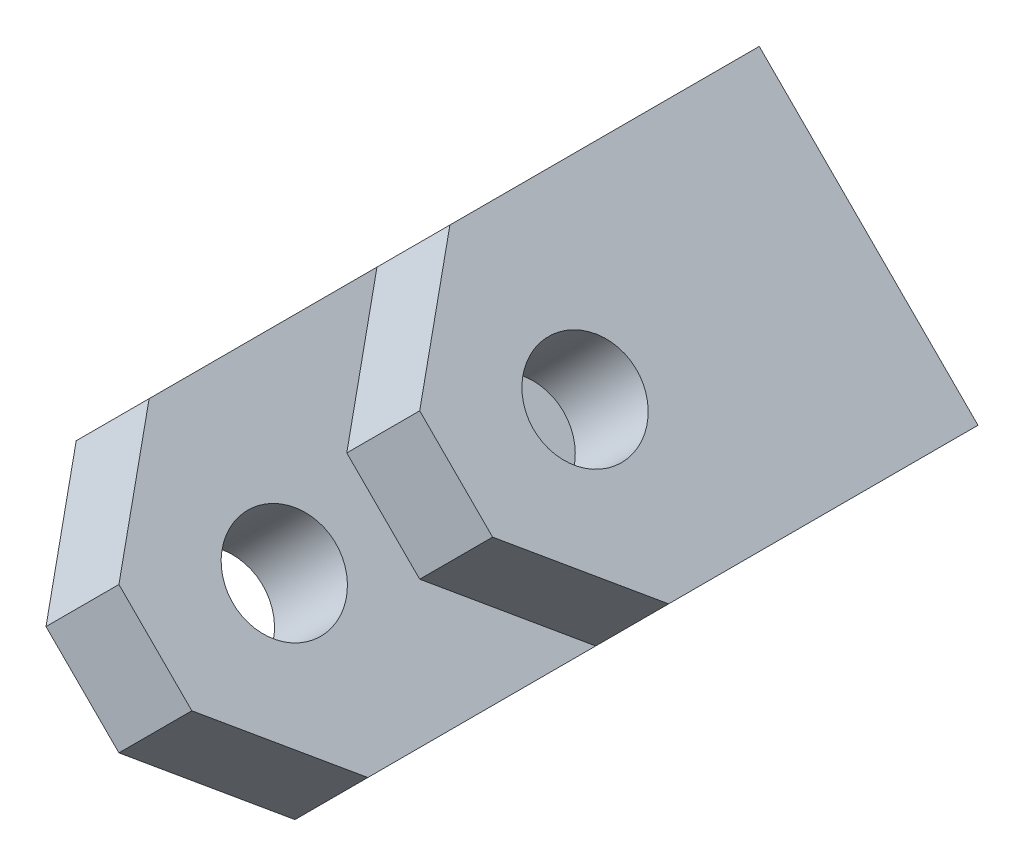
from build123d import *

# Parameters (mm, degrees)
EXTRUDE1_DEPTH     = 101.6
EXTRUDE1_2_DEPTH   = 101.6
SKETCH2_R          = 12.7
CUT_EXTRUDE1_DEPTH = 197.56814499


with BuildPart() as part:
    # Sketch1 → Extrude1 (new body)
    with BuildSketch(Plane.XY):
        Polygon((-55.004068742, -1.122532015), (-1.122532015, -55.004068742), (-19.083044257, -72.964580984), (-72.964580984, -19.083044257), align=None)
    extrude(amount=EXTRUDE1_DEPTH)


with BuildPart() as body_2:
    # Sketch1 → Extrude1 2 (new body)
    with BuildSketch(Plane.XY):
        Polygon((1.122532015, 55.004068742), (55.004068742, 1.122532015), (72.964580984, 19.083044257), (19.083044257, 72.964580984), align=None)
    extrude(amount=EXTRUDE1_2_DEPTH)


with BuildPart() as cut_extrude1_tool:
    # Sketch2 → Cut-Extrude1 (new, through all)
    with BuildSketch(Plane(origin=(-46.02381262, -46.02381262, 0), x_dir=(0.7071067811865462, -0.7071067811865488, 0), z_dir=(-0.7071067811865488, -0.7071067811865462, 0))):
        with Locations((0, 69.85)):
            Circle(SKETCH2_R)
        Polygon((-12.7, 101.6), (-38.1, 76.2), (-38.1, 101.6), align=None)
        Polygon((12.7, 101.6), (38.1, 76.2), (38.1, 101.6), align=None)
    extrude(amount=-CUT_EXTRUDE1_DEPTH)


with BuildPart() as part_1:
    add(part.part)

    # Cut-Extrude1: cut by cut_extrude1_tool
    add(cut_extrude1_tool.part, mode=Mode.SUBTRACT)


with BuildPart() as body_2_1:
    add(body_2.part)

    # Cut-Extrude1: cut by cut_extrude1_tool
    add(cut_extrude1_tool.part, mode=Mode.SUBTRACT)


solid = Compound([part_1.part, body_2_1.part])
